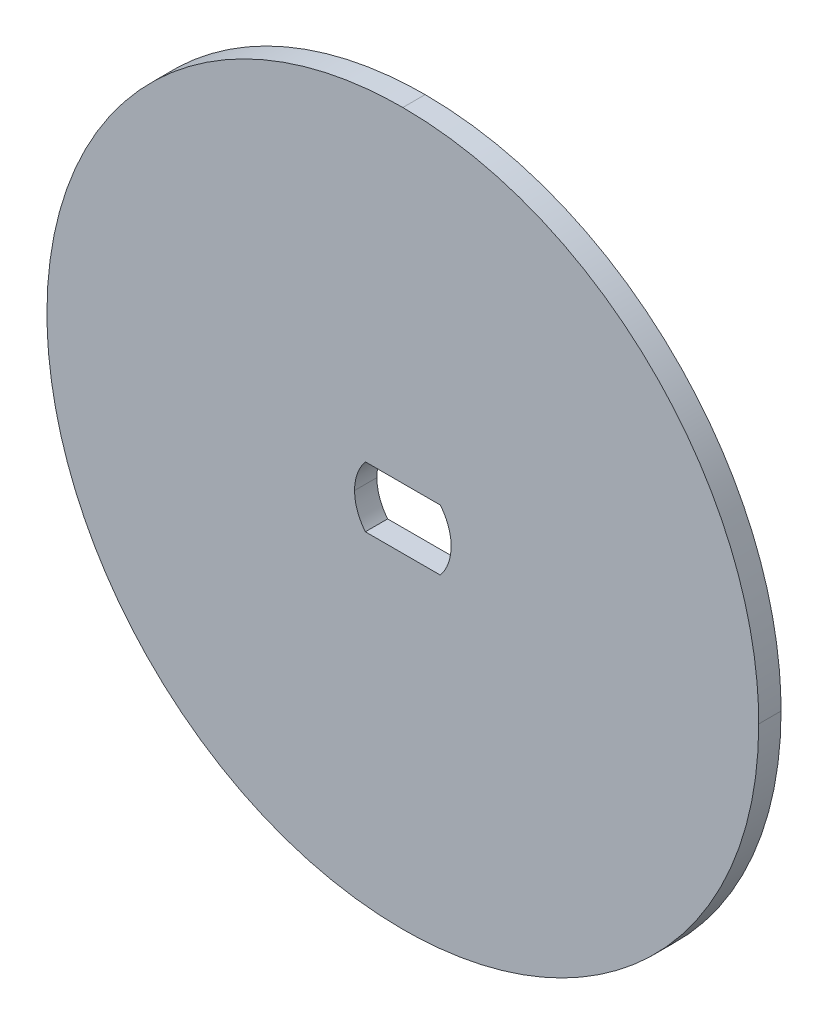
from build123d import *

# Parameters (mm, degrees)
BOSS_EXTRUDE6_DEPTH = 1.5875


with BuildPart() as part:
    # retainer → Boss-Extrude6 (new body)
    with BuildSketch(Plane.XY):
        with BuildLine():
            add(Edge.make_bspline(
                [(50.012832, 180.595493), (63.995642, 180.595493), (75.330974, 169.260162), (75.330974, 155.277352)],
                knots=[0, 0, 0, 0, 1, 1, 1, 1], degree=3))
            add(Edge.make_bspline(
                [(75.330974, 155.277352), (75.330974, 141.294514), (63.995642, 129.959211), (50.012832, 129.959211)],
                knots=[0, 0, 0, 0, 1, 1, 1, 1], degree=3))
            add(Edge.make_bspline(
                [(50.012832, 129.959211), (36.029994, 129.959211), (24.694691, 141.294514), (24.694691, 155.277352)],
                knots=[0, 0, 0, 0, 1, 1, 1, 1], degree=3))
            add(Edge.make_bspline(
                [(24.694691, 155.277352), (24.694691, 169.260162), (36.029994, 180.595493), (50.012832, 180.595493)],
                knots=[0, 0, 0, 0, 1, 1, 1, 1], degree=3))
        make_face()
        with BuildLine():
            add(Edge.make_bspline(
                [(53.448004, 155.28176), (53.448004, 156.099908), (53.158396, 156.843852), (52.680713, 157.433705)],
                knots=[0, 0, 0, 0, 1, 1, 1, 1], degree=3))
            Line((52.680713, 157.433705), (47.344952, 157.433705))
            add(Edge.make_bspline(
                [(47.344952, 157.433705), (46.867268, 156.843852), (46.57766, 156.099908), (46.57766, 155.28176)],
                knots=[0, 0, 0, 0, 1, 1, 1, 1], degree=3))
            add(Edge.make_bspline(
                [(46.57766, 155.28176), (46.57766, 154.463612), (46.867268, 153.710849), (47.344952, 153.120996)],
                knots=[0, 0, 0, 0, 1, 1, 1, 1], degree=3))
            Line((47.344952, 153.120996), (52.680713, 153.120996))
            add(Edge.make_bspline(
                [(52.680713, 153.120996), (53.158396, 153.710849), (53.448004, 154.463612), (53.448004, 155.28176)],
                knots=[0, 0, 0, 0, 1, 1, 1, 1], degree=3))
        make_face(mode=Mode.SUBTRACT)
    extrude(amount=BOSS_EXTRUDE6_DEPTH)


solid = part.part
